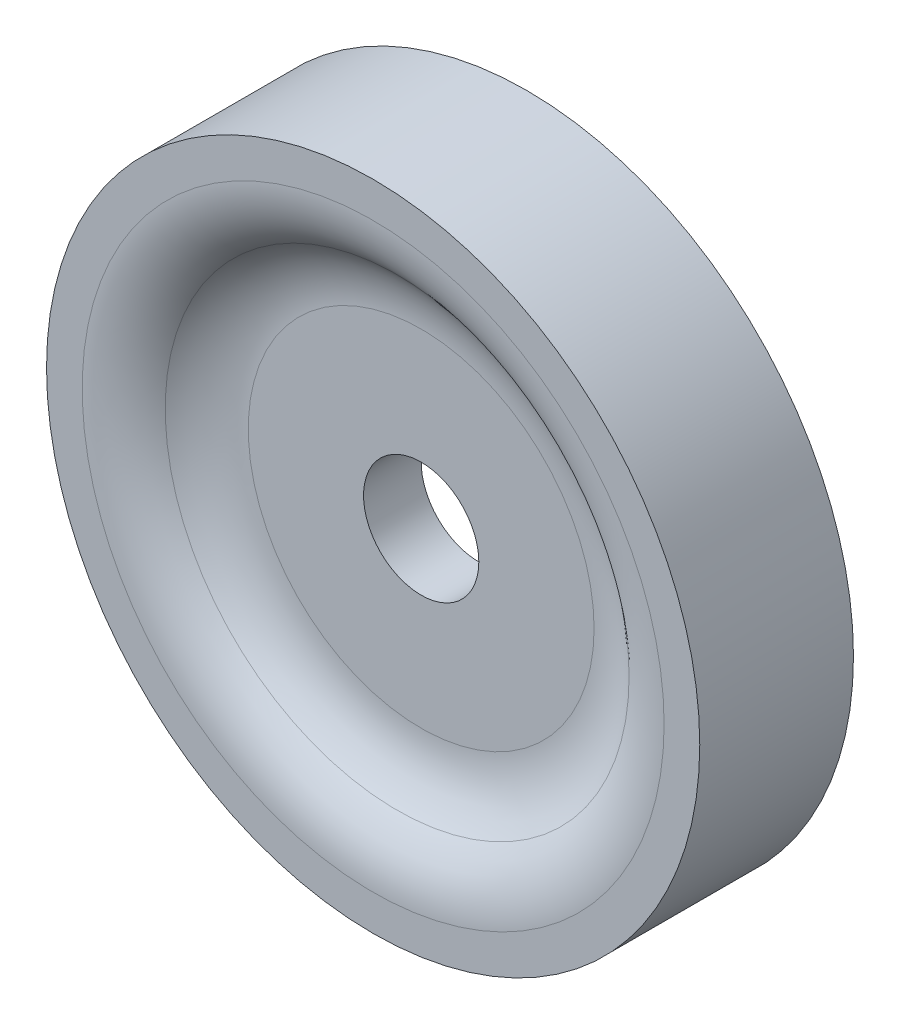
from build123d import *


with BuildPart() as part:
    # Croquis2 → Revolución1 (revolve)
    with BuildSketch(Plane(origin=(0, 0, 0), x_dir=(1, 0, 0), z_dir=(0, 1, 0))):
        with BuildLine():
            Line((15, -7.5), (15, 7.5))
            Line((15, 7.5), (45, 7.5))
            ThreePointArc((45, 7.5), (53.291561976, 9.122316128), (60.360257159, 13.75))
            ThreePointArc((60.360257159, 13.75), (67.428952343, 18.377683872), (75.720514319, 20))
            Line((75.720514319, 20), (85, 20))
            Line((85, 20), (85, -20))
            Line((85, -20), (75.720514319, -20))
            ThreePointArc((75.720514319, -20), (67.428952343, -18.377683872), (60.360257159, -13.75))
            ThreePointArc((60.360257159, -13.75), (53.291561976, -9.122316128), (45, -7.5))
            Line((45, -7.5), (15, -7.5))
        make_face()
    revolve(axis=Axis((0, 0, 0), (0, 0, -1)))


solid = part.part
